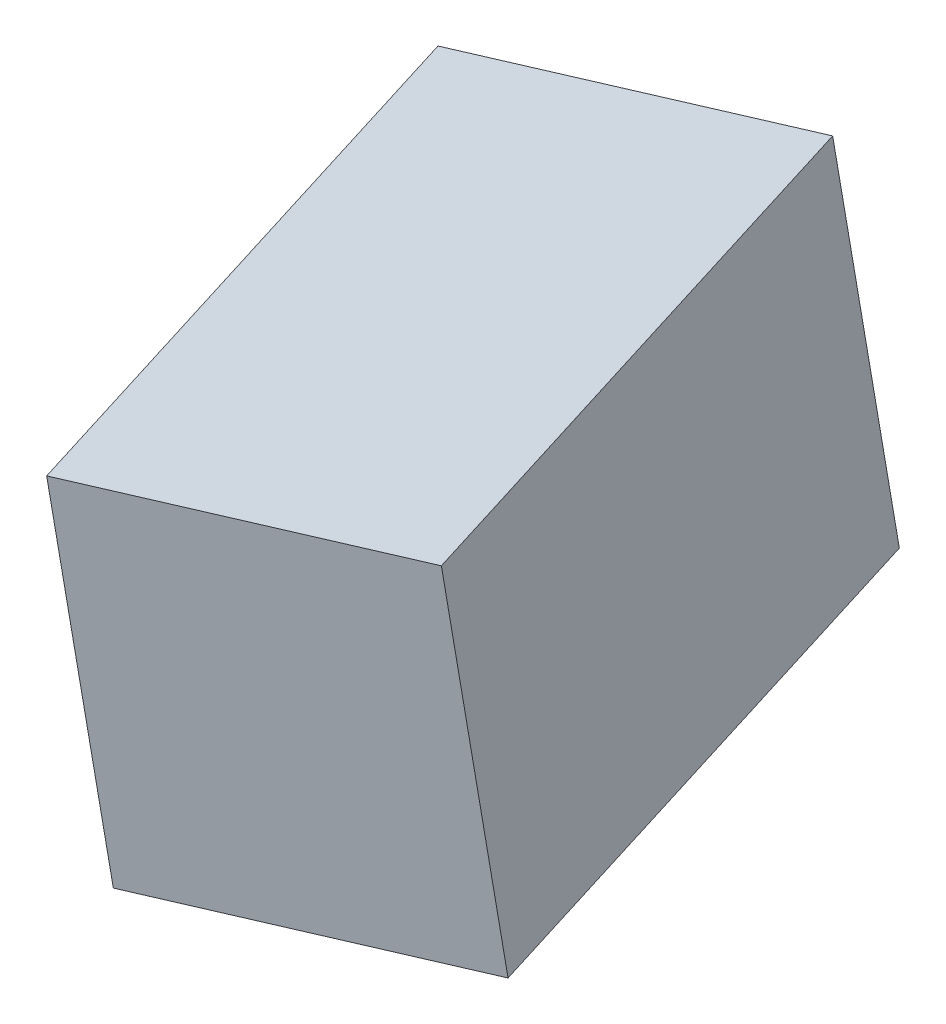
from build123d import *

# Parameters (mm, degrees)
SKETCH_2_W      = 55
SKETCH_2_H      = 85
EXTRUDE_1_DEPTH = 50


with BuildPart() as part:
    # 草图2 → 凸台-拉伸1 (new body)
    with BuildSketch(Plane(origin=(-1970.034425118, 250.688482387, 166.146144515), x_dir=(0.09738475766310611, -0.9913004955533004, -0.08854115704393853), z_dir=(0.9612211533070375, 0.11674580192282241, -0.24984857848001818))):
        with Locations((-117.787397724, 23.019936139)):
            Rectangle(SKETCH_2_W, SKETCH_2_H)
    extrude(amount=EXTRUDE_1_DEPTH)


solid = part.part
